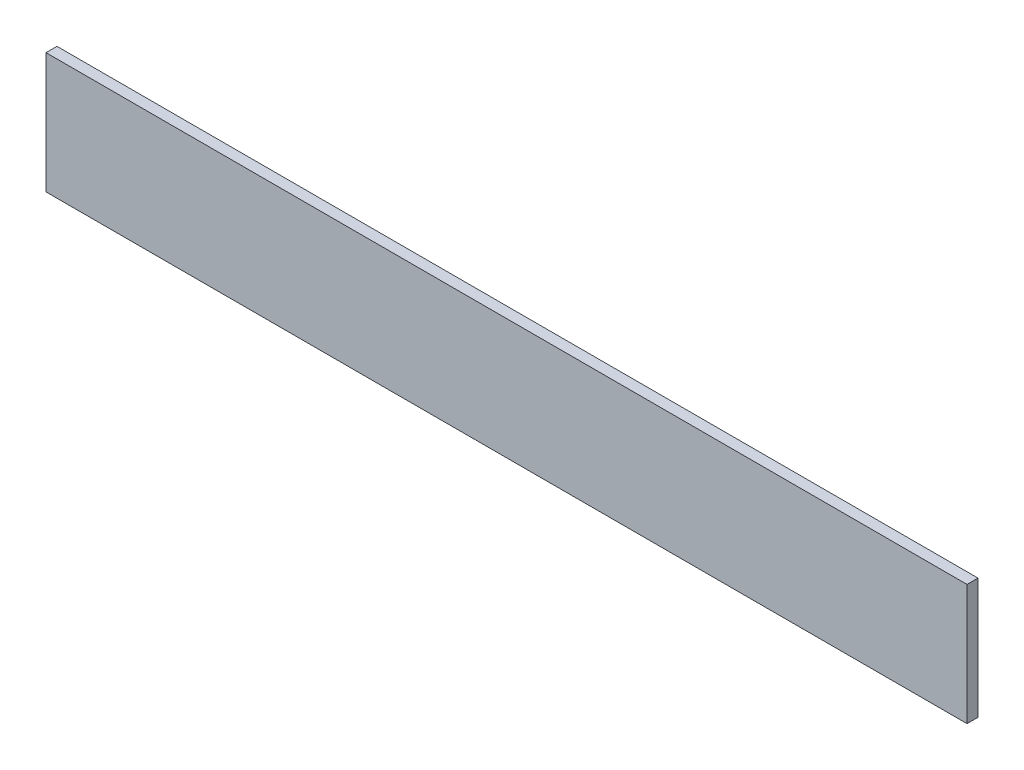
from build123d import *

# Parameters (mm, degrees)
SKETCH_1_W      = 420
SKETCH_1_H      = 55
EXTRUDE_1_DEPTH = 5


with BuildPart() as part:
    # 스케치1 → 보스-돌출1 (new body)
    with BuildSketch(Plane.XY):
        Rectangle(SKETCH_1_W, SKETCH_1_H)
    extrude(amount=EXTRUDE_1_DEPTH)


solid = part.part
